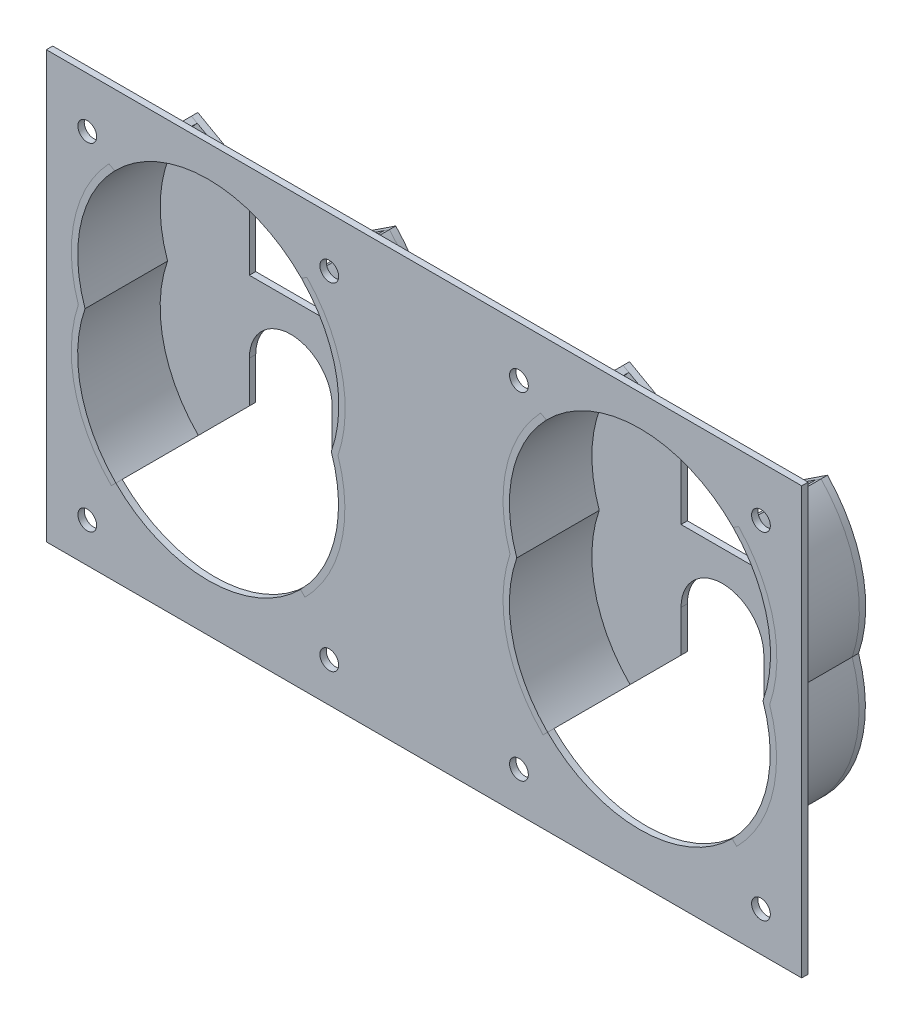
from build123d import *

# Parameters (mm, degrees)
BOSS_EXTRUDE1_DEPTH   = 12.954
BOSS_EXTRUDE1_2_DEPTH = 12.954
BOSS_EXTRUDE1_3_DEPTH = 12.954
BOSS_EXTRUDE1_4_DEPTH = 12.954
SKETCH1_5_W           = 118.614322008
SKETCH1_5_H           = 66.932160629
SKETCH1_5_R           = 1.4732
BOSS_EXTRUDE7_DEPTH   = 1
BOSS_EXTRUDE8_DEPTH   = 1
BOSS_EXTRUDE8_2_DEPTH = 1


with BuildPart() as part:
    # Sketch1 → Boss-Extrude1 (new body)
    with BuildSketch(Plane(origin=(0, 0, 24.694917193), x_dir=(-1, 0, 0), z_dir=(0, 0, -1))):
        with BuildLine():
            Line((-26.711239732, -25.926461717), (-27.418356705, -26.633560376))
            ThreePointArc((-27.418356705, -26.633560376), (-33.103898465, -16.427883163), (-32.606315955, -4.755966263))
            ThreePointArc((-32.606315955, -4.755966263), (-33.212872936, 6.817494073), (-27.723683277, 17.024437416))
            Line((-27.723683277, 17.024437416), (-26.873543442, 16.464449956))
            ThreePointArc((-26.873543442, 16.464449956), (-32.253152748, 6.526489502), (-31.549394168, -4.75216193))
            ThreePointArc((-31.549394168, -4.75216193), (-32.168953824, -16.033615513), (-26.711239732, -25.926461717))
        make_face()
    extrude(amount=BOSS_EXTRUDE1_DEPTH)


with BuildPart() as body_2:
    # Sketch1 → Boss-Extrude1 2 (new body)
    with BuildSketch(Plane(origin=(0, 0, 24.694917193), x_dir=(-1, 0, 0), z_dir=(0, 0, -1))):
        with BuildLine():
            Line((2.271842608, -25.95414115), (2.978940339, -26.661256992))
            ThreePointArc((2.978940339, -26.661256992), (8.697616612, -16.404714138), (8.167257761, -4.673616614))
            ThreePointArc((8.167257761, -4.673616614), (8.753052566, 6.786952267), (3.360296242, 16.916412955))
            Line((3.360296242, 16.916412955), (2.459590829, 16.410495208))
            ThreePointArc((2.459590829, 16.410495208), (7.785713157, 6.530099053), (7.11032923, -4.674081586))
            ThreePointArc((7.11032923, -4.674081586), (7.76203635, -16.012359065), (2.271842608, -25.95414115))
        make_face()
    extrude(amount=BOSS_EXTRUDE1_2_DEPTH)


with BuildPart() as body_3:
    # Sketch1 → Boss-Extrude1 3 (new body)
    with BuildSketch(Plane(origin=(0, 0, 24.694917193), x_dir=(-1, 0, 0), z_dir=(0, 0, -1))):
        with BuildLine():
            Line((40.061312196, 17.024347064), (40.911450673, 16.464353309))
            ThreePointArc((40.911450673, 16.464353309), (35.531738914, 6.526878162), (36.234922811, -4.751430369))
            ThreePointArc((36.234922811, -4.751430369), (35.612355655, -16.034911484), (41.068452193, -25.931150492))
            Line((41.068452193, -25.931150492), (40.361330704, -26.638245326))
            ThreePointArc((40.361330704, -26.638245326), (34.677350547, -16.429116332), (35.177966741, -4.755071247))
            ThreePointArc((35.177966741, -4.755071247), (34.572040238, 6.81796561), (40.061312196, 17.024347064))
        make_face()
    extrude(amount=BOSS_EXTRUDE1_3_DEPTH)


with BuildPart() as body_4:
    # Sketch1 → Boss-Extrude1 4 (new body)
    with BuildSketch(Plane(origin=(0, 0, 24.694917193), x_dir=(-1, 0, 0), z_dir=(0, 0, -1))):
        with BuildLine():
            Line((70.244185819, 16.410340589), (71.144898793, 16.916255594))
            ThreePointArc((71.144898793, 16.916255594), (76.536957488, 6.790628874), (75.954602378, -4.666398488))
            ThreePointArc((75.954602378, -4.666398488), (76.490482856, -16.40442492), (70.770513911, -26.668458613))
            Line((70.770513911, -26.668458613), (70.063420356, -25.961338606))
            ThreePointArc((70.063420356, -25.961338606), (75.554797046, -16.01227522), (74.897640471, -4.667354531))
            ThreePointArc((74.897640471, -4.667354531), (75.569676563, 6.533548794), (70.244185819, 16.410340589))
        make_face()
    extrude(amount=BOSS_EXTRUDE1_4_DEPTH)


with BuildPart() as body_5:
    # Sketch1<5> → Boss-Extrude7 (new body)
    with BuildSketch(Plane(origin=(0, 0, 24.694917193), x_dir=(-1, 0, 0), z_dir=(0, 0, -1))):
        with Locations((21.673839127, -5.951687391)):
            Rectangle(SKETCH1_5_W, SKETCH1_5_H)
        with Locations((-31.233446035, -33.224517796)):
            Circle(SKETCH1_5_R, mode=Mode.SUBTRACT)
        with Locations((6.766553887, -33.225006242)):
            Circle(SKETCH1_5_R, mode=Mode.SUBTRACT)
        with Locations((36.550977194, -33.224405729)):
            Circle(SKETCH1_5_R, mode=Mode.SUBTRACT)
        with Locations((74.550977113, -33.225118305)):
            Circle(SKETCH1_5_R, mode=Mode.SUBTRACT)
        with BuildLine():
            ThreePointArc((2.271842608, -25.95414115), (-12.225437728, -31.949771243), (-26.711239732, -25.926461717))
            Line((-26.711239732, -25.926461717), (-27.418356705, -26.633560376))
            ThreePointArc((-27.418356705, -26.633560376), (-33.103898465, -16.427883163), (-32.606315955, -4.755966263))
            ThreePointArc((-32.606315955, -4.755966263), (-33.212872936, 6.817494073), (-27.723683277, 17.024437416))
            Line((-27.723683277, 17.024437416), (-26.873543442, 16.464449956))
            ThreePointArc((-26.873543442, 16.464449956), (-12.195614215, 22.614607616), (2.459590829, 16.410495208))
            Line((2.459590829, 16.410495208), (3.360296242, 16.916412955))
            ThreePointArc((3.360296242, 16.916412955), (8.753052566, 6.786952267), (8.167257761, -4.673616614))
            ThreePointArc((8.167257761, -4.673616614), (8.697616612, -16.404714138), (2.978940339, -26.661256992))
            Line((2.978940339, -26.661256992), (2.271842608, -25.95414115))
        make_face(mode=Mode.SUBTRACT)
        with Locations((-31.232766774, 19.620482705)):
            Circle(SKETCH1_5_R, mode=Mode.SUBTRACT)
        with Locations((6.767233148, 19.619994259)):
            Circle(SKETCH1_5_R, mode=Mode.SUBTRACT)
        with BuildLine():
            ThreePointArc((35.177966741, -4.755071247), (34.572040238, 6.81796561), (40.061312196, 17.024347064))
            Line((40.061312196, 17.024347064), (40.911450673, 16.464353309))
            ThreePointArc((40.911450673, 16.464353309), (55.589192289, 22.614258134), (70.244185819, 16.410340589))
            Line((70.244185819, 16.410340589), (71.144898793, 16.916255594))
            ThreePointArc((71.144898793, 16.916255594), (76.536957488, 6.790628874), (75.954602378, -4.666398488))
            ThreePointArc((75.954602378, -4.666398488), (76.490482856, -16.40442492), (70.770513911, -26.668458613))
            Line((70.770513911, -26.668458613), (70.063420356, -25.961338606))
            ThreePointArc((70.063420356, -25.961338606), (55.559675255, -31.959805369), (41.068452193, -25.931150492))
            Line((41.068452193, -25.931150492), (40.361330704, -26.638245326))
            ThreePointArc((40.361330704, -26.638245326), (34.677350547, -16.429116332), (35.177966741, -4.755071247))
        make_face(mode=Mode.SUBTRACT)
        with Locations((36.551968143, 19.620594767)):
            Circle(SKETCH1_5_R, mode=Mode.SUBTRACT)
        with Locations((74.551968061, 19.619882191)):
            Circle(SKETCH1_5_R, mode=Mode.SUBTRACT)
    extrude(amount=BOSS_EXTRUDE7_DEPTH)


with BuildPart() as body_6:
    # Sketch4 → Boss-Extrude8 (new body)
    with BuildSketch(Plane(origin=(0, 0, 11.740917193), x_dir=(-1, 0, 0), z_dir=(0, 0, -1))):
        with BuildLine():
            ThreePointArc((35.177966741, -4.755071247), (34.677350547, -16.429116332), (40.361330704, -26.638245326))
            Line((40.361330704, -26.638245326), (49.051264407, -17.948639189))
            Line((49.051264407, -17.948639189), (49.051264407, -11.448944696))
            ThreePointArc((49.051264407, -11.448944696), (55.551264423, -4.948944679), (62.05126444, -11.448944696))
            Line((62.05126444, -11.448944696), (62.05126444, -17.948882965))
            Line((62.05126444, -17.948882965), (70.770513911, -26.668458613))
            ThreePointArc((70.770513911, -26.668458613), (76.490482856, -16.40442492), (75.954602378, -4.666398488))
            ThreePointArc((75.954602378, -4.666398488), (76.536957488, 6.790628874), (71.144898793, 16.916255594))
            Line((71.144898793, 16.916255594), (62.05126444, 11.808517386))
            Line((62.05126444, 11.808517386), (62.05126444, -0.173638647))
            Line((62.05126444, -0.173638647), (49.051264407, -0.173638647))
            Line((49.051264407, -0.173638647), (49.051264407, 11.102585807))
            Line((49.051264407, 11.102585807), (40.061312196, 17.024347064))
            ThreePointArc((40.061312196, 17.024347064), (34.572040238, 6.81796561), (35.177966741, -4.755071247))
        make_face()
    extrude(amount=BOSS_EXTRUDE8_DEPTH)


with BuildPart() as body_7:
    # Sketch4 → Boss-Extrude8 2 (new body)
    with BuildSketch(Plane(origin=(0, 0, 11.740917193), x_dir=(-1, 0, 0), z_dir=(0, 0, -1))):
        with BuildLine():
            ThreePointArc((8.167257761, -4.673616614), (8.753052566, 6.786952267), (3.360296242, 16.916412955))
            Line((3.360296242, 16.916412955), (-5.73302041, 11.808782641))
            Line((-5.73302041, 11.808782641), (-5.73302041, -0.17384409))
            Line((-5.73302041, -0.17384409), (-18.733020444, -0.17367699))
            Line((-18.733020444, -0.17367699), (-18.733020444, 11.102284103))
            Line((-18.733020444, 11.102284103), (-27.723683277, 17.024437416))
            ThreePointArc((-27.723683277, 17.024437416), (-33.212872936, 6.817494073), (-32.606315955, -4.755966263))
            ThreePointArc((-32.606315955, -4.755966263), (-33.103898465, -16.427883163), (-27.418356705, -26.633560376))
            Line((-27.418356705, -26.633560376), (-18.733248921, -17.948677527))
            Line((-18.733248921, -17.948677527), (-18.733248921, -11.448944686))
            ThreePointArc((-18.733248921, -11.448944686), (-12.233248904, -4.948944669), (-5.733248887, -11.448944686))
            Line((-5.733248887, -11.448944686), (-5.733248887, -17.948844627))
            Line((-5.733248887, -17.948844627), (2.978940339, -26.661256992))
            ThreePointArc((2.978940339, -26.661256992), (8.697616612, -16.404714138), (8.167257761, -4.673616614))
        make_face()
    extrude(amount=BOSS_EXTRUDE8_2_DEPTH)


solid = Compound([part.part, body_2.part, body_3.part, body_4.part, body_5.part, body_6.part, body_7.part])
